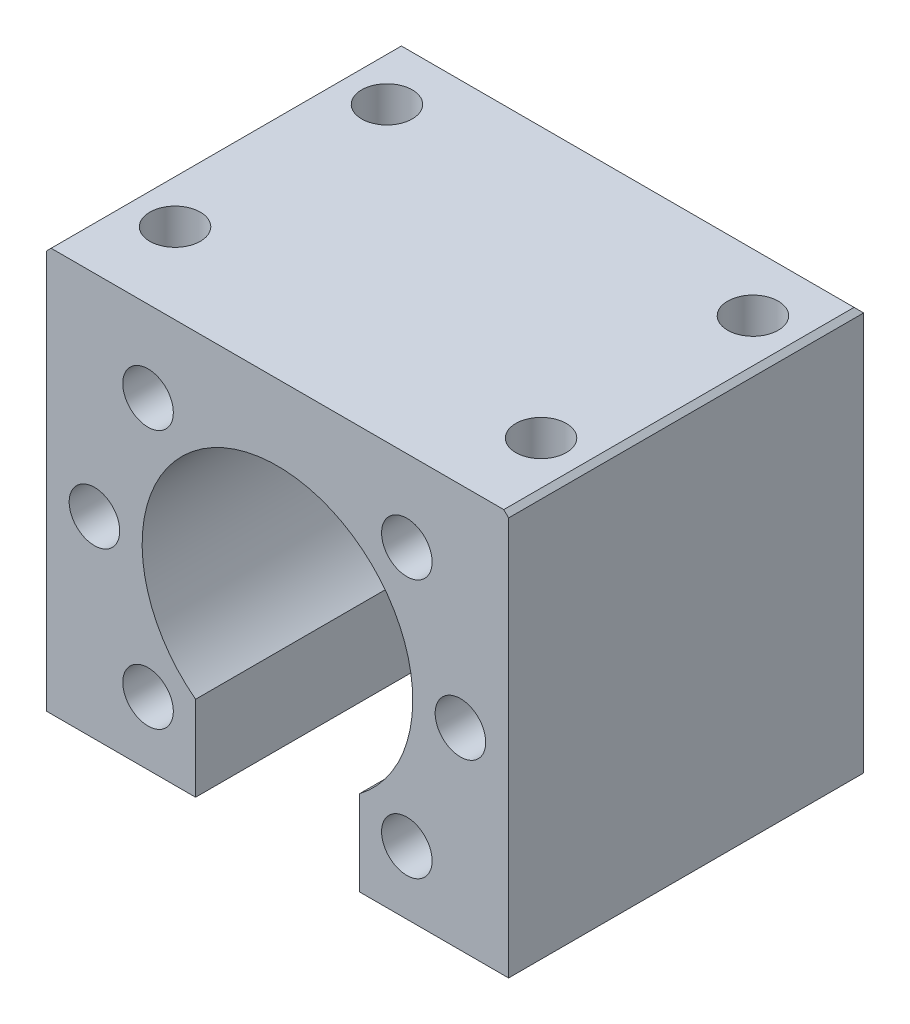
from build123d import *
from build123d.topology import SkipClean

# Parameters (mm, degrees)
EXTRUSION1_DEPTH = 36.869499995
THREAD6_D        = 5.25
THREAD6_DEPTH    = 20
THREAD6_TIP      = 1.577259125
THREAD10_D       = 5.25
THREAD10_DEPTH   = 17
SKETCH6_W        = 48
SKETCH6_H        = 36.869499995
SKETCH6_R        = 2.625
EXTRUSION2_DEPTH = 1.869499995
CHAMFER2_SIZE    = 0.5


with BuildPart() as part:
    # Sketch1 → Extrusion1 (new body)
    with BuildSketch(Plane.XY):
        with BuildLine():
            Line((-24, 20), (24, 20))
            Line((24, 20), (24, -20))
            Line((24, -20), (8.5, -20))
            Line((8.5, -20), (8.5, -11.187157816))
            ThreePointArc((8.5, -11.187157816), (0, 14.05), (-8.5, -11.187157816))
            Line((-8.5, -11.187157816), (-8.5, -20))
            Line((-8.5, -20), (-24, -20))
            Line((-24, -20), (-24, 20))
        make_face()
    extrude(amount=EXTRUSION1_DEPTH)

    # Thread6
    with Locations(Plane.XY.offset(36.869499995)):
        with Locations((-19, 0), (-13.435028843, -13.435028843), (-13.435028843, 13.435028843), (13.435028843, 13.435028843), (19, 0), (13.435028843, -13.435028843)):
            Hole(THREAD6_D / 2, depth=THREAD6_DEPTH)
            with Locations((0, 0, -(THREAD6_DEPTH + THREAD6_TIP / 2))):  # 118° drill point
                Cone(0, THREAD6_D / 2, THREAD6_TIP, mode=Mode.SUBTRACT)

    # Thread10
    with Locations(Plane(origin=(0, 20, 0), x_dir=(1, 0, 0), z_dir=(0, 1, 0))):
        with Locations((-19, -6.5), (19, -6.5), (-19, -28.5), (19, -28.5)):
            Hole(THREAD10_D / 2, depth=THREAD10_DEPTH)

    # Sketch6 → Extrusion2 (add)
    with SkipClean():  # the faces are left unmerged after this step: merging them gives an invalid solid
        with BuildSketch(Plane(origin=(0, 20, 0), x_dir=(-1, 0, 0), z_dir=(0, 1, 0))):
            with Locations((0, 18.434749998)):
                Rectangle(SKETCH6_W, SKETCH6_H)
            with Locations(Location((19, 28.5, 0), (0, 0, 90))):
                Circle(SKETCH6_R, mode=Mode.SUBTRACT)
            with Locations(Location((19, 6.5, 0), (0, 0, 90))):
                Circle(SKETCH6_R, mode=Mode.SUBTRACT)
            with Locations(Location((-19, 6.5, 0), (0, 0, 90))):
                Circle(SKETCH6_R, mode=Mode.SUBTRACT)
            with Locations(Location((-19, 28.5, 0), (0, 0, 90))):
                Circle(SKETCH6_R, mode=Mode.SUBTRACT)
        extrude(amount=EXTRUSION2_DEPTH)

    # Chamfer2
    chamfer2_edges = [part.edges().sort_by_distance(p)[0] for p in [
        (24, 21.869499995, 18.434749997),
        (0, 21.869499995, 0),
        (-24, 21.869499995, 18.434749997),
    ]]
    chamfer(chamfer2_edges, length=CHAMFER2_SIZE)


solid = part.part
